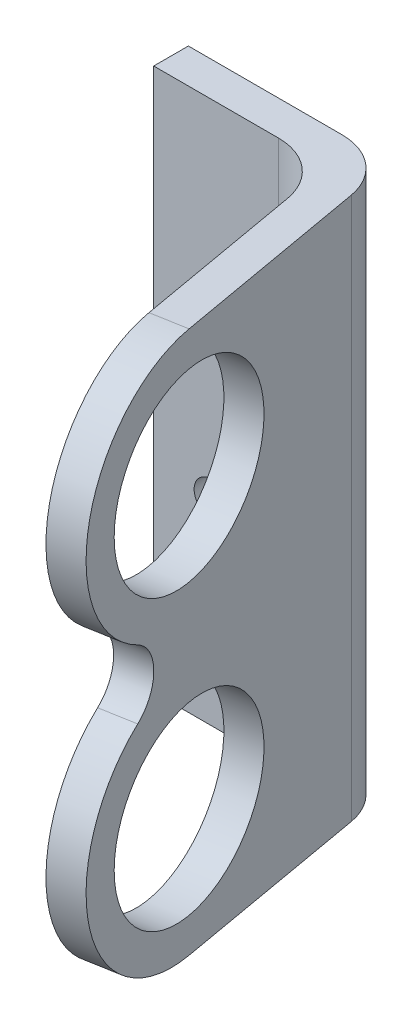
from build123d import *

# Parameters (mm, degrees)
BOSS_EXTRUDE1_DEPTH = 47
SKETCH2_R           = 1.5
CUT_EXTRUDE1_DEPTH  = 60.29842776
SKETCH3_R           = 8
CUT_EXTRUDE2_DEPTH  = 56.153261701


with BuildPart() as part:
    # Sketch1 → Boss-Extrude1 (new body)
    with BuildSketch(Plane(origin=(0, 0, 0), x_dir=(1, 0, 0), z_dir=(0, 1, 0))):
        with BuildLine():
            Line((-2.32059976, 10.913457617), (11.001200978, 10.913457617))
            ThreePointArc((11.001200978, 10.913457617), (14.215139026, 9.743679833), (15.925239743, 6.781698506))
            Line((15.925239743, 6.781698506), (20.843268829, -21.10983044))
            Line((20.843268829, -21.10983044), (17.88884557, -21.630774973))
            Line((17.88884557, -21.630774973), (13.407940849, 3.781698506))
            ThreePointArc((13.407940849, 3.781698506), (11.697840132, 6.743679833), (8.483902084, 7.913457617))
            Line((8.483902084, 7.913457617), (-2.32059976, 7.913457617))
            Line((-2.32059976, 7.913457617), (-2.32059976, 10.913457617))
        make_face()
    extrude(amount=BOSS_EXTRUDE1_DEPTH)

    # Sketch2 → Cut-Extrude1 (cut, through all)
    with BuildSketch(Plane.XY.offset(-7.913457617)):
        with Locations((2.67940024, 30)):
            Circle(SKETCH2_R)
        with Locations((2.67940024, 17)):
            Circle(SKETCH2_R)
    extrude(amount=-CUT_EXTRUDE1_DEPTH, mode=Mode.SUBTRACT)

    # Sketch3 → Cut-Extrude2 (cut, through all)
    with BuildSketch(Plane(origin=(13.650350495, 0, -2.406925088), x_dir=(0.1736481776669272, 0, 0.9848077530122087), z_dir=(-0.9848077530122087, 0, 0.1736481776669272))):
        with BuildLine():
            Line((24.408520331, 47), (13.408520331, 47))
            ThreePointArc((13.408520331, 47), (21.186694924, 43.778174593), (24.408520331, 36))
            Line((24.408520331, 36), (24.408520331, 47))
        make_face()
        with BuildLine():
            Line((24.408520331, 0), (24.408520331, 11))
            ThreePointArc((24.408520331, 11), (21.186694924, 3.221825407), (13.408520331, 0))
            Line((13.408520331, 0), (24.408520331, 0))
        make_face()
        with Locations((13.408520331, 11)):
            Circle(SKETCH3_R)
        with Locations((13.408520331, 36)):
            Circle(SKETCH3_R)
        with BuildLine():
            Line((24.408520331, 11), (24.408520331, 36))
            ThreePointArc((24.408520331, 36), (22.930853605, 30.493170692), (18.894853235, 26.465842918))
            ThreePointArc((18.894853235, 26.465842918), (17.17968635, 23.5), (18.894853235, 20.534157082))
            ThreePointArc((18.894853235, 20.534157082), (22.930853605, 16.506829308), (24.408520331, 11))
        make_face()
    extrude(amount=-CUT_EXTRUDE2_DEPTH, mode=Mode.SUBTRACT)


solid = part.part
